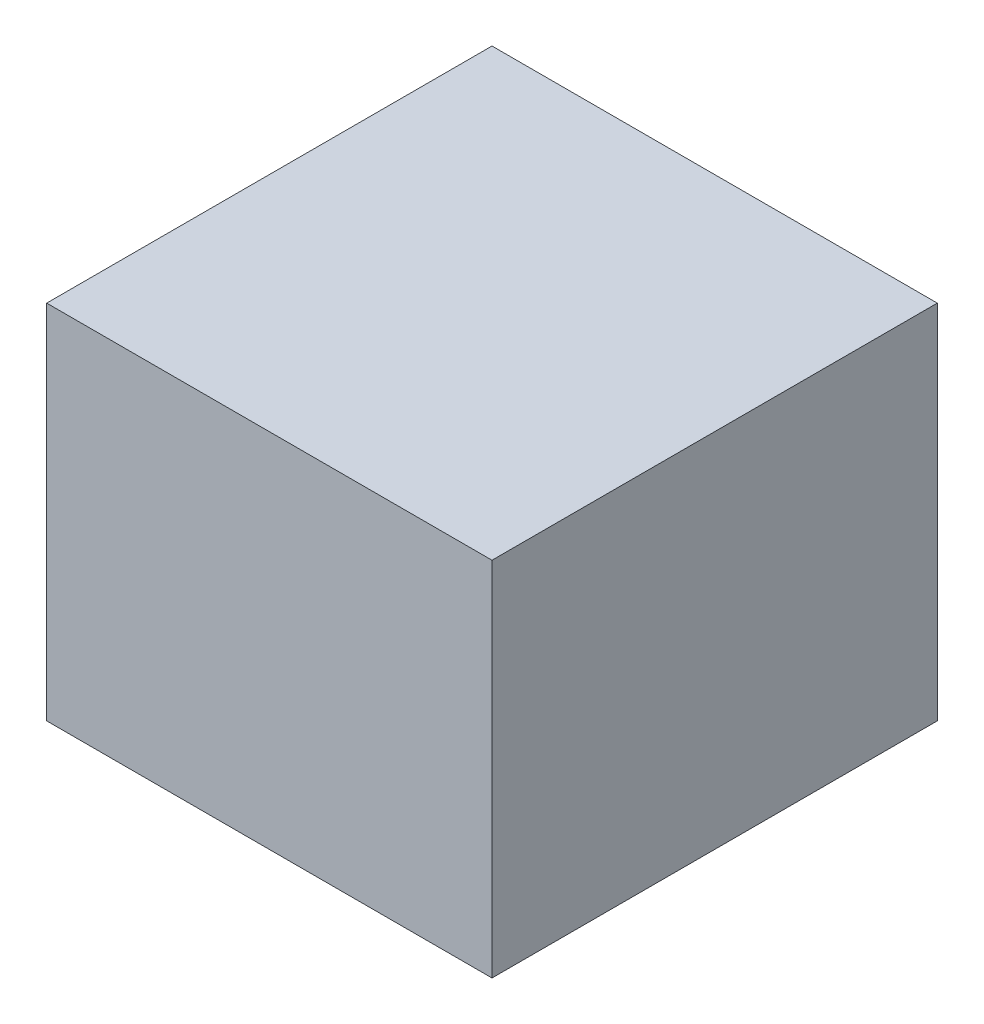
from build123d import *

# Parameters (mm, degrees)
EXTRUDE_1_DEPTH      = 100
EXTRUDE_1_DEPTH_BACK = 30
SKETCH_1_W           = 160
SKETCH_1_H           = 160


with BuildPart() as part:
    # 草图1 → 凸台-拉伸1 (new, two sides: drawn at the far end of the back side and taken through both)
    with BuildSketch(Plane(origin=(0, 0, 0), x_dir=(1, 0, 0), z_dir=(0, 1, 0)).offset(-EXTRUDE_1_DEPTH_BACK)):
        Rectangle(SKETCH_1_W, SKETCH_1_H)
    extrude(amount=EXTRUDE_1_DEPTH + EXTRUDE_1_DEPTH_BACK)


solid = part.part
